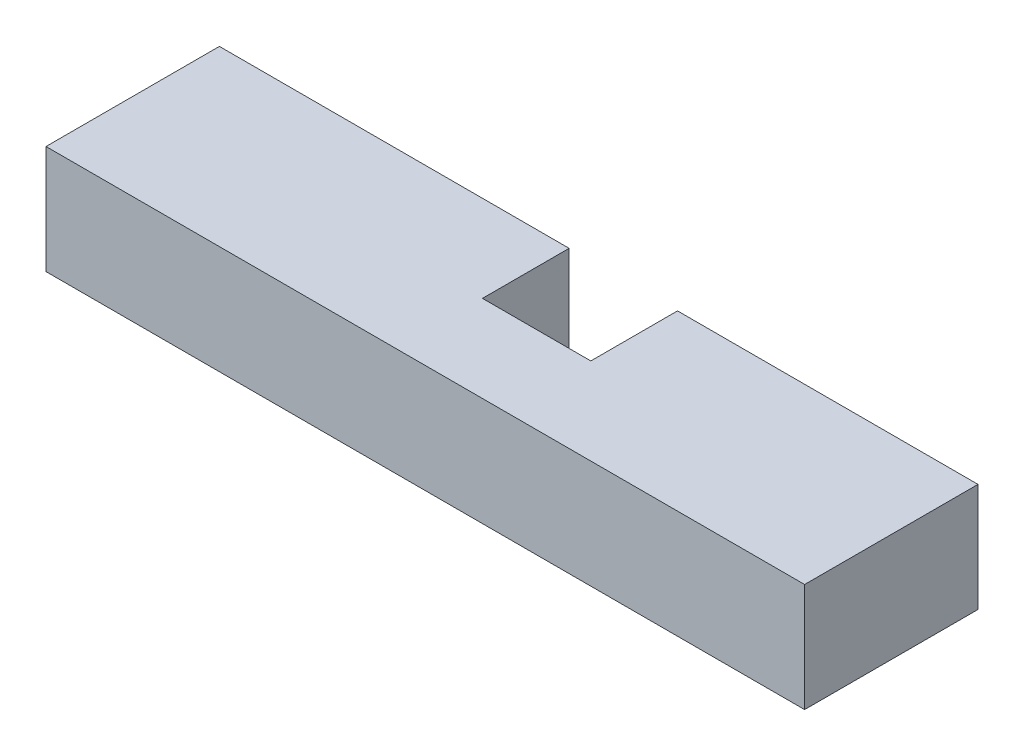
from build123d import *

# Parameters (mm, degrees)
BOSS_EXTRUDE1_DEPTH = 6.35


with BuildPart() as part:
    # Elevator Paddle Support Strut → Boss-Extrude1 (new body)
    with BuildSketch(Plane(origin=(0, 0, 0), x_dir=(1, 0, 0), z_dir=(0, 1, 0))):
        Polygon((-22.225, -5.08), (22.225, -5.08), (22.225, 5.08), (4.617903309, 5.08), (4.617903309, 0), (-1.732096691, 0), (-1.732096691, 5.08), (-22.225, 5.08), align=None)
    extrude(amount=BOSS_EXTRUDE1_DEPTH)


solid = part.part
